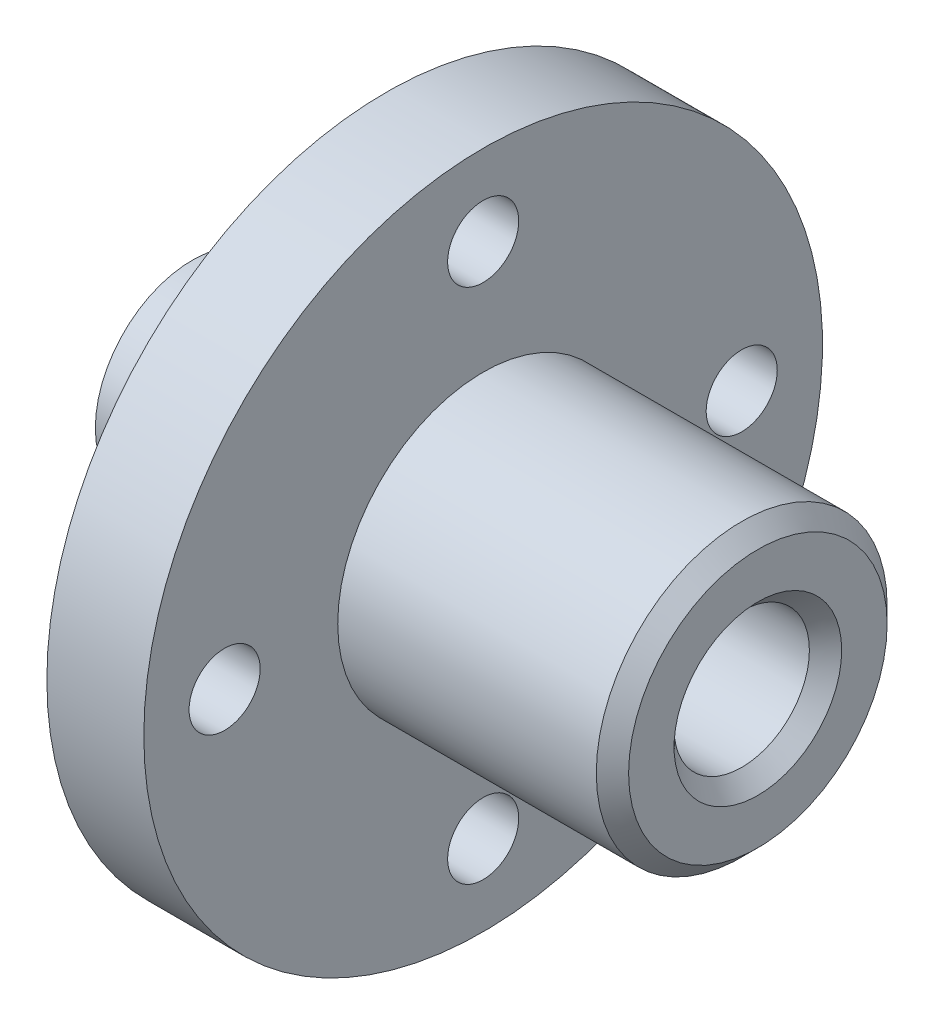
from build123d import *

# Parameters (mm, degrees)
CHAMFER_1_SIZE           = 1
SKETCH_2_R               = 2.2
CUT_EXTRUDE_1_DEPTH      = 38.563279942
PATTERN_CIRCULAR_1_COUNT = 4


with BuildPart() as part:
    # Эскиз1 → Повернуть1 (revolve)
    with BuildSketch(Plane.XY, mode=Mode.PRIVATE) as revolve_1_sk:
        Polygon((0, -3.5), (0, -6), (6.2, -6), (6.2, -11), (8.2, -11), (8.2, -10.75), (12, -10.75), (12, -21), (18, -21), (18, -9), (35, -9), (35, -4.188), (25, -4.188), (22.582057073, 0), (19.020725942, 0), (17, -3.5), align=None)
    revolve(revolve_1_sk.sketch.rotate(Axis((0, 0, 0), (1, 0, 0)), 270), axis=Axis((0, 0, 0), (1, 0, 0)))

    # Фаска1
    chamfer_1_edges = [part.edges().sort_by_distance(p)[0] for p in [
        (35, 0, -4.188),
        (35, 0, -9),
    ]]
    chamfer(chamfer_1_edges, length=CHAMFER_1_SIZE)

    # Эскиз2 → Вырез-Вытянуть1 (cut, through all)
    with BuildSketch(Plane.ZY.offset(-12)):
        with Locations((0, 16)):
            Circle(SKETCH_2_R)
    cut_extrude_1 = extrude(amount=-CUT_EXTRUDE_1_DEPTH, mode=Mode.SUBTRACT)

    # Круговой массив1: Вырез-Вытянуть1 ×4 about axis
    pattern_circular_1_axis = Axis((0, 0, 0), (1, 0, 0))
    for i in range(1, PATTERN_CIRCULAR_1_COUNT):
        add(cut_extrude_1.rotate(pattern_circular_1_axis, i * 360 / PATTERN_CIRCULAR_1_COUNT), mode=Mode.SUBTRACT)


solid = part.part
